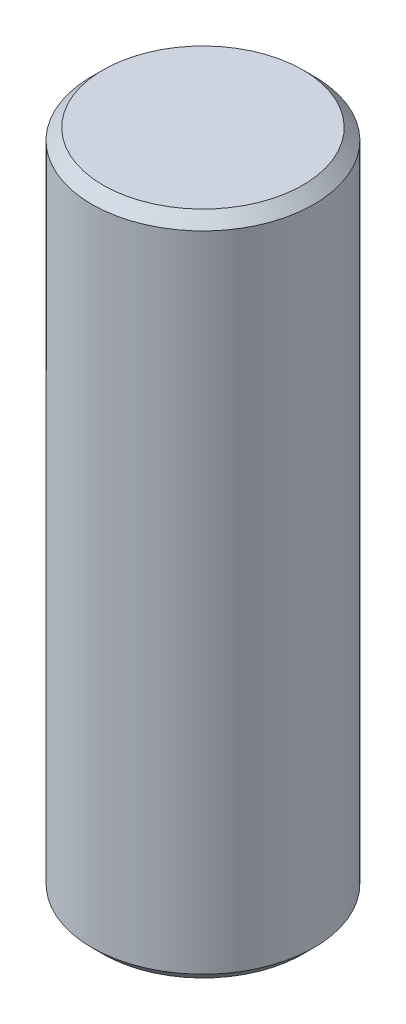
from build123d import *

# Parameters (mm, degrees)
SKETCH_1_R      = 2
EXTRUDE_1_DEPTH = 12
CHAMFER_1_SIZE  = 0.2


with BuildPart() as part:
    # 草图1 → 凸台-拉伸1 (new body)
    with BuildSketch(Plane(origin=(0, 0, 0), x_dir=(1, 0, 0), z_dir=(0, 1, 0))):
        with Locations(Location((0, 0, 0), (0, 0, 270))):
            Circle(SKETCH_1_R)
    extrude(amount=EXTRUDE_1_DEPTH)

    # 倒角1
    chamfer_1_edges = [part.edges().sort_by_distance(p)[0] for p in [
        (0, 0, -2),
        (0, 12, -2),
    ]]
    chamfer(chamfer_1_edges, length=CHAMFER_1_SIZE)


solid = part.part
